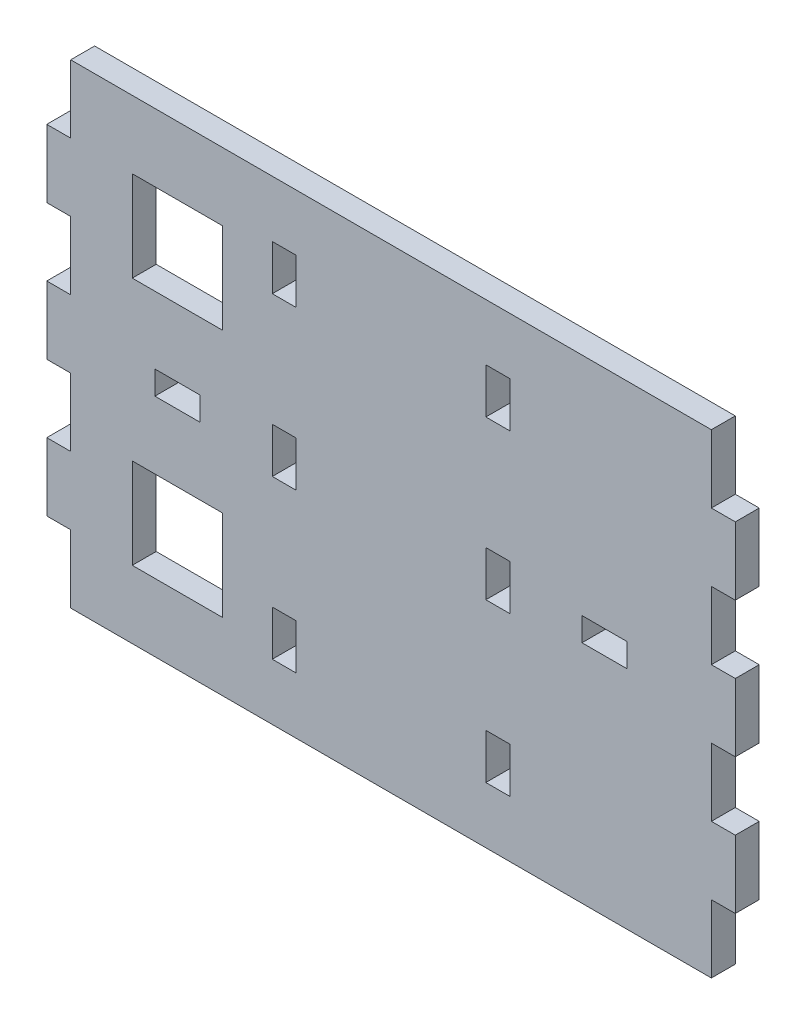
from build123d import *

# Parameters (mm, degrees)
SKETCH1_W           = 12
SKETCH1_H           = 12
SKETCH1_W_2         = 6
SKETCH1_H_2         = 3.125
SKETCH1_W_3         = 3.175
SKETCH1_H_3         = 6
BOSS_EXTRUDE1_DEPTH = 1.5875


with BuildPart() as part:
    # Sketch1 → Boss-Extrude1 (new, symmetric)
    with BuildSketch(Plane.XY):
        Polygon((45.675, 0), (45.675, 4.5), (42.5, 4.5), (42.5, 13.5), (45.675, 13.5), (45.675, 22.5), (42.5, 22.5), (42.5, 31.5), (-42.5, 31.5), (-42.5, 22.5), (-45.675, 22.5), (-45.675, 13.5), (-42.5, 13.5), (-42.5, 4.5), (-45.675, 4.5), (-45.675, -4.5), (-42.5, -4.5), (-42.5, -13.5), (-45.675, -13.5), (-45.675, -22.5), (-42.5, -22.5), (-42.5, -31.5), (42.5, -31.5), (42.5, -22.5), (45.675, -22.5), (45.675, -13.5), (42.5, -13.5), (42.5, -4.5), (45.675, -4.5), align=None)
        with Locations((-28.333333333, -16.5)):
            Rectangle(SKETCH1_W, SKETCH1_H, mode=Mode.SUBTRACT)
        with Locations((-28.333333333, 0)):
            Rectangle(SKETCH1_W_2, SKETCH1_H_2, mode=Mode.SUBTRACT)
        with Locations((-28.333333333, 16.5)):
            Rectangle(SKETCH1_W, SKETCH1_H, mode=Mode.SUBTRACT)
        with Locations((-14.166666667, -21)):
            Rectangle(SKETCH1_W_3, SKETCH1_H_3, mode=Mode.SUBTRACT)
        with Locations((14.166666667, -21)):
            Rectangle(SKETCH1_W_3, SKETCH1_H_3, mode=Mode.SUBTRACT)
        with Locations((-14.166666667, 0)):
            Rectangle(SKETCH1_W_3, SKETCH1_H_3, mode=Mode.SUBTRACT)
        with Locations((-14.166666667, 21)):
            Rectangle(SKETCH1_W_3, SKETCH1_H_3, mode=Mode.SUBTRACT)
        with Locations((14.166666667, 0)):
            Rectangle(SKETCH1_W_3, SKETCH1_H_3, mode=Mode.SUBTRACT)
        Polygon((31.333333333, 1.5625), (31.333333333, 0), (31.333333333, -1.5625), (25.333333333, -1.5625), (25.333333333, 1.5625), align=None, mode=Mode.SUBTRACT)
        with Locations((14.166666667, 21)):
            Rectangle(SKETCH1_W_3, SKETCH1_H_3, mode=Mode.SUBTRACT)
    extrude(amount=BOSS_EXTRUDE1_DEPTH, both=True)


solid = part.part
